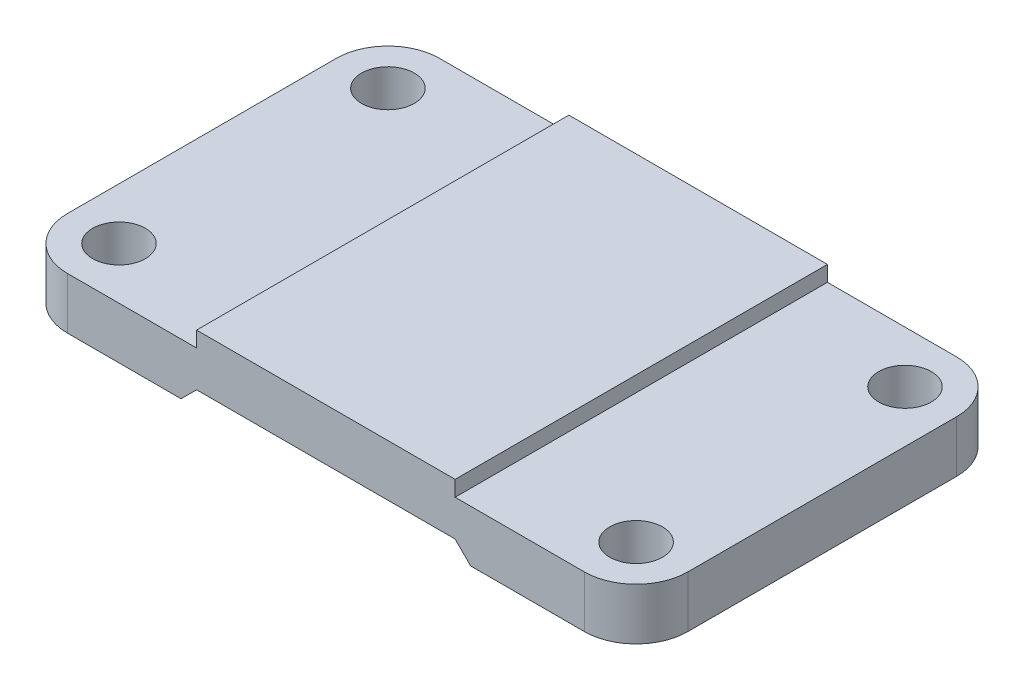
from build123d import *

# Parameters (mm, degrees)
SKETCH1_W                    = 120
SKETCH1_H                    = 72
BOSS_EXTRUDE1_DEPTH          = 10
FILLET1_R                    = 10
M12_TAPPED_HOLE1_D           = 10.2
M12_TAPPED_HOLE1_CSINK_D     = 12.05
M12_TAPPED_HOLE1_CSINK_ANGLE = 90
BOSS_EXTRUDE2_START          = 10
SKETCH4_W                    = 50
SKETCH4_H                    = 72
BOSS_EXTRUDE2_DEPTH          = 3
CUT_EXTRUDE1_DEPTH           = 72.168813395
CUT_EXTRUDE1_DEPTH_BACK      = 72.168813395


with BuildPart() as part:
    # Sketch1 → Boss-Extrude1 (new body)
    with BuildSketch(Plane(origin=(0, 0, 0), x_dir=(1, 0, 0), z_dir=(0, 1, 0))):
        Rectangle(SKETCH1_W, SKETCH1_H)
    extrude(amount=BOSS_EXTRUDE1_DEPTH)

    # Fillet1
    fillet1_edges = [part.edges().sort_by_distance(p)[0] for p in [
        (60, 5, 36),
        (-60, 5, 36),
        (-60, 5, -36),
        (60, 5, -36),
    ]]
    fillet(fillet1_edges, radius=FILLET1_R)

    # M12 Tapped Hole1 (through all)
    with Locations(Plane.XZ):
        with Locations((-50, -26), (50, -26), (50, 26), (-50, 26)):
            CounterSinkHole(M12_TAPPED_HOLE1_D / 2, M12_TAPPED_HOLE1_CSINK_D / 2, counter_sink_angle=M12_TAPPED_HOLE1_CSINK_ANGLE)

    # Sketch4 → Boss-Extrude2 (add)
    with BuildSketch(Plane(origin=(0, 0, 0), x_dir=(1, 0, 0), z_dir=(0, 1, 0)).offset(BOSS_EXTRUDE2_START)):
        Rectangle(SKETCH4_W, SKETCH4_H)
    extrude(amount=BOSS_EXTRUDE2_DEPTH)

    # Sketch5 → Cut-Extrude1 (cut, two sides: drawn at the far end of the back side and taken through both)
    with BuildSketch(Plane.XY.offset(-CUT_EXTRUDE1_DEPTH_BACK)):
        Polygon((-28, 0), (-25, 3), (25, 3), (28, 0), align=None)
    extrude(amount=CUT_EXTRUDE1_DEPTH + CUT_EXTRUDE1_DEPTH_BACK, mode=Mode.SUBTRACT)


solid = part.part
